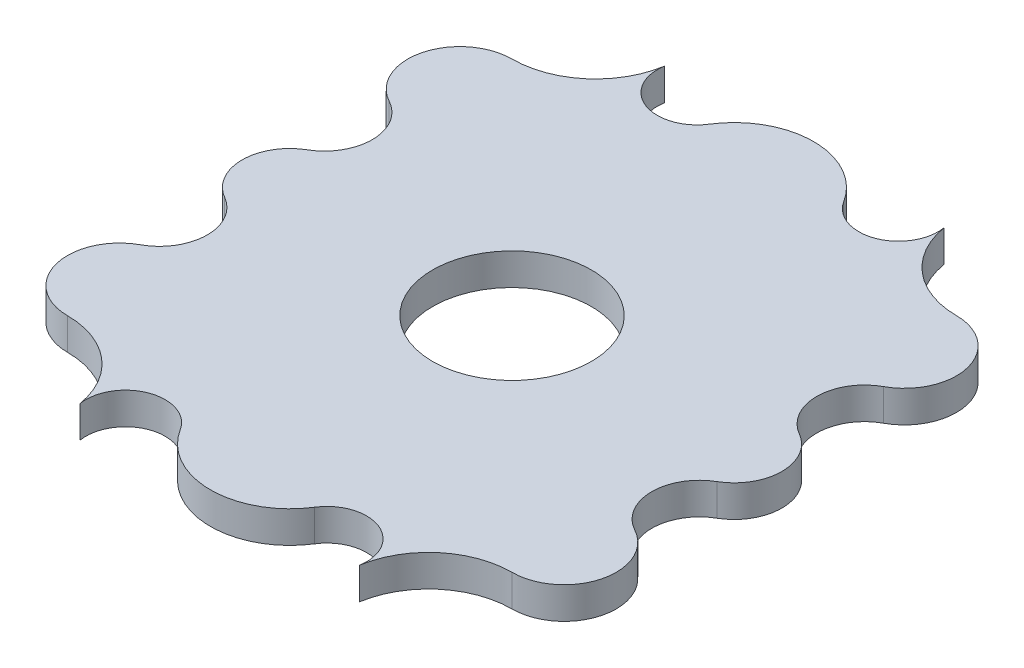
from build123d import *

# Parameters (mm, degrees)
SALIENTE_EXTRUIR1_DEPTH = 10
SALIENTE_EXTRUIR2_DEPTH = 10
CROQUIS3_R              = 25
CORTAR_EXTRUIR1_DEPTH   = 10


with BuildPart() as part:
    # Croquis1 → Saliente-Extruir1 (new body)
    with BuildSketch(Plane(origin=(0, 0, 0), x_dir=(1, 0, 0), z_dir=(0, 1, 0))):
        with BuildLine():
            Line((-70, -70), (-70, 70))
            ThreePointArc((-70, 70), (-52.983030462, 76.249658661), (-44.055908755, 92.027554074))
            ThreePointArc((-44.055908755, 92.027554074), (-36.156795126, 78.313355526), (-21.147629234, 83.333333333))
            ThreePointArc((-21.147629234, 83.333333333), (0, 95), (21.147629234, 83.333333333))
            ThreePointArc((21.147629234, 83.333333333), (36.156795126, 78.313355526), (44.055908755, 92.027554074))
            ThreePointArc((44.055908755, 92.027554074), (52.983030462, 76.249658661), (70, 70))
            Line((70, 70), (70, -70))
            ThreePointArc((70, -70), (52.983030462, -76.249658661), (44.055908755, -92.027554074))
            ThreePointArc((44.055908755, -92.027554074), (36.156795126, -78.313355526), (21.147629234, -83.333333333))
            ThreePointArc((21.147629234, -83.333333333), (0, -95), (-21.147629234, -83.333333333))
            ThreePointArc((-21.147629234, -83.333333333), (-36.156795126, -78.313355526), (-44.055908755, -92.027554074))
            ThreePointArc((-44.055908755, -92.027554074), (-52.983030462, -76.249658661), (-70, -70))
        make_face()
    extrude(amount=SALIENTE_EXTRUIR1_DEPTH)

    # Croquis2 → Saliente-Extruir2 (add)
    with BuildSketch(Plane(origin=(0, 10, 0), x_dir=(1, 0, 0), z_dir=(0, 1, 0))):
        with BuildLine():
            Line((-70, 25.98076189), (-70, 70))
            ThreePointArc((-70, 70), (-85.909969357, 57.627811916), (-77.837993487, 39.160506523))
            ThreePointArc((-77.837993487, 39.160506523), (-72.107558403, 33.647896498), (-70, 25.98076189))
        make_face()
        with BuildLine():
            ThreePointArc((77.837993487, 39.160506523), (85.909969357, 57.627811916), (70, 70))
            Line((70, 70), (70, 25.98076213))
            ThreePointArc((70, 25.98076213), (72.107558465, 33.647896602), (77.837993487, 39.160506523))
        make_face()
        with BuildLine():
            ThreePointArc((77.5, 12.990381057), (72.009618939, 18.480762121), (70, 25.98076213))
            Line((70, 25.98076213), (70, -25.98076213))
            ThreePointArc((70, -25.98076213), (72.009618939, -18.480762121), (77.5, -12.990381057))
            ThreePointArc((77.5, -12.990381057), (85, 0), (77.5, 12.990381057))
        make_face()
        with BuildLine():
            Line((-70, -25.980762199), (-70, 25.98076189))
            ThreePointArc((-70, 25.98076189), (-72.009618999, 18.480762017), (-77.5, 12.990381057))
            ThreePointArc((-77.5, 12.990381057), (-85, 0), (-77.5, -12.990381057))
            ThreePointArc((-77.5, -12.990381057), (-72.009618922, -18.480762151), (-70, -25.980762199))
        make_face()
        with BuildLine():
            Line((-70, -70), (-70, -25.980762199))
            ThreePointArc((-70, -25.980762199), (-72.107558482, -33.647896631), (-77.837993487, -39.160506523))
            ThreePointArc((-77.837993487, -39.160506523), (-85.909969357, -57.627811916), (-70, -70))
        make_face()
        with BuildLine():
            ThreePointArc((77.837993487, -39.160506523), (72.107558465, -33.647896602), (70, -25.98076213))
            Line((70, -25.98076213), (70, -70))
            ThreePointArc((70, -70), (85.909969357, -57.627811916), (77.837993487, -39.160506523))
        make_face()
    extrude(amount=-SALIENTE_EXTRUIR2_DEPTH)

    # Croquis3 → Cortar-Extruir1 (cut)
    with BuildSketch(Plane(origin=(0, 10, 0), x_dir=(1, 0, 0), z_dir=(0, 1, 0))):
        with Locations(Location((0, 0, 0), (0, 0, 270))):
            Circle(CROQUIS3_R)
    extrude(amount=-CORTAR_EXTRUIR1_DEPTH, mode=Mode.SUBTRACT)


solid = part.part
